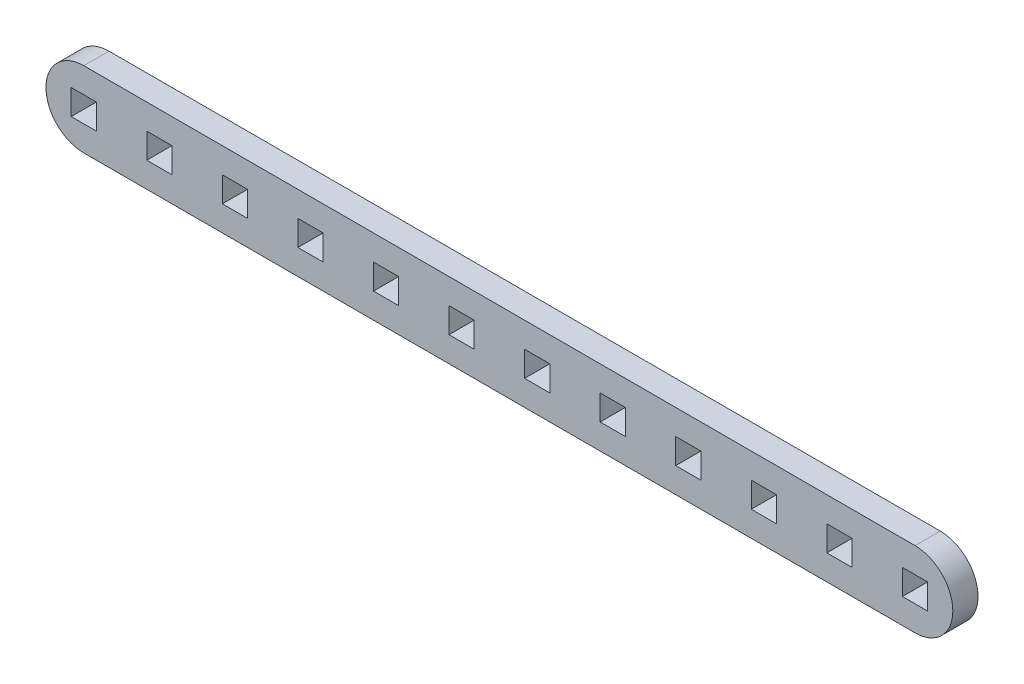
from build123d import *

# Parameters (mm, degrees)
MODEL_W                 = 3
MODEL_H                 = 3
SALIENTE_EXTRUIR1_DEPTH = 3


with BuildPart() as part:
    # Model → Saliente-Extruir1 (new body)
    with BuildSketch(Plane.XY):
        with BuildLine():
            Line((9.904781567, 296.774995526), (108.904781567, 296.774995526))
            ThreePointArc((108.904781567, 296.774995526), (113.404781567, 292.274995526), (108.904781567, 287.774995526))
            Line((108.904781567, 287.774995526), (9.904781567, 287.774995526))
            ThreePointArc((9.904781567, 287.774995526), (5.404781567, 292.274995526), (9.904781567, 296.774995526))
        make_face()
        with Locations((9.904781567, 292.274995526)):
            Rectangle(MODEL_W, MODEL_H, mode=Mode.SUBTRACT)
        with Locations((18.904781567, 292.274995526)):
            Rectangle(MODEL_W, MODEL_H, mode=Mode.SUBTRACT)
        with Locations((27.904781567, 292.274995526)):
            Rectangle(MODEL_W, MODEL_H, mode=Mode.SUBTRACT)
        with Locations((36.904781567, 292.274995526)):
            Rectangle(MODEL_W, MODEL_H, mode=Mode.SUBTRACT)
        with Locations((45.904781567, 292.274995526)):
            Rectangle(MODEL_W, MODEL_H, mode=Mode.SUBTRACT)
        with Locations((54.904781567, 292.274995526)):
            Rectangle(MODEL_W, MODEL_H, mode=Mode.SUBTRACT)
        with Locations((63.904781567, 292.274995526)):
            Rectangle(MODEL_W, MODEL_H, mode=Mode.SUBTRACT)
        with Locations((72.904781567, 292.274995526)):
            Rectangle(MODEL_W, MODEL_H, mode=Mode.SUBTRACT)
        with Locations((81.904781567, 292.274995526)):
            Rectangle(MODEL_W, MODEL_H, mode=Mode.SUBTRACT)
        with Locations((90.904781567, 292.274995526)):
            Rectangle(MODEL_W, MODEL_H, mode=Mode.SUBTRACT)
        with Locations((108.904781567, 292.274995526)):
            Rectangle(MODEL_W, MODEL_H, mode=Mode.SUBTRACT)
        with Locations((99.904781567, 292.274995526)):
            Rectangle(MODEL_W, MODEL_H, mode=Mode.SUBTRACT)
    extrude(amount=SALIENTE_EXTRUIR1_DEPTH)


solid = part.part
